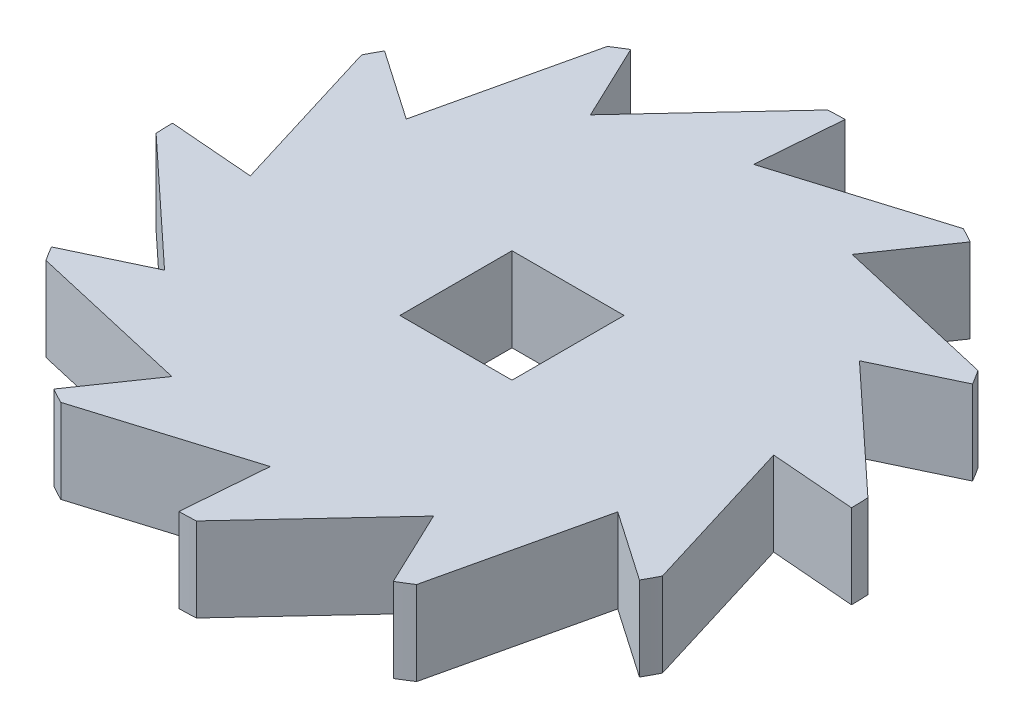
from build123d import *

# Parameters (mm, degrees)
SCHIZZO1_R                    = 30
SCHIZZO1_W                    = 10
SCHIZZO1_H                    = 10
ESTRUSIONE_ESTRUSIONE1_DEPTH  = 7.5
TAGLIO_ESTRUSIONE1_DEPTH      = 44.084219849
TAGLIO_ESTRUSIONE1_DEPTH_BACK = 44.084219849


with BuildPart() as part:
    # Schizzo1 → Estrusione-Estrusione1 (new body)
    with BuildSketch(Plane(origin=(0, 0, 0), x_dir=(1, 0, 0), z_dir=(0, 1, 0))):
        with Locations(Location((0, 0, 0), (0, 0, 270))):
            Circle(SCHIZZO1_R)
        Rectangle(SCHIZZO1_W, SCHIZZO1_H, mode=Mode.SUBTRACT)
    extrude(amount=ESTRUSIONE_ESTRUSIONE1_DEPTH)

    # Schizzo2 → Taglio-Estrusione1 (cut, two sides: drawn at the far end of the back side and taken through both)
    with BuildSketch(Plane(origin=(0, 7.5, 0), x_dir=(1, 0, 0), z_dir=(0, 1, 0)).offset(-TAGLIO_ESTRUSIONE1_DEPTH_BACK)):
        with BuildLine():
            Line((-19.887270315, 10.454237391), (-16.532028162, 25.033818024))
            ThreePointArc((-16.532028162, 25.033818024), (-21.93796515, 20.462787813), (-26.122238482, 14.75224243))
            Line((-26.122238482, 14.75224243), (-19.887270315, 10.454237391))
        make_face()
        with BuildLine():
            Line((-22.45, -0.89), (-26.834065376, 13.413908282))
            ThreePointArc((-26.834065376, 13.413908282), (-29.230229034, 6.752311504), (-29.998643344, -0.285302534))
            Line((-29.998643344, -0.285302534), (-22.45, -0.89))
        make_face()
        with BuildLine():
            Line((-18.997270315, -11.995762609), (-29.945936443, -1.800247352))
            ThreePointArc((-29.945936443, -1.800247352), (-28.690276653, -8.76744122), (-25.836935948, -15.246400914))
            Line((-25.836935948, -15.246400914), (-18.997270315, -11.995762609))
        make_face()
        with BuildLine():
            Line((-10.454237391, -19.887270315), (-25.033818024, -16.532028162))
            ThreePointArc((-25.033818024, -16.532028162), (-20.462787813, -21.93796515), (-14.75224243, -26.122238482))
            Line((-14.75224243, -26.122238482), (-10.454237391, -19.887270315))
        make_face()
        with BuildLine():
            ThreePointArc((-13.413908282, -26.834065376), (-6.752311504, -29.230229034), (0.285302534, -29.998643344))
            Line((0.285302534, -29.998643344), (0.89, -22.45))
            Line((0.89, -22.45), (-13.413908282, -26.834065376))
        make_face()
        with BuildLine():
            ThreePointArc((1.800247352, -29.945936443), (8.76744122, -28.690276653), (15.246400914, -25.836935948))
            Line((15.246400914, -25.836935948), (11.995762609, -18.997270315))
            Line((11.995762609, -18.997270315), (1.800247352, -29.945936443))
        make_face()
        with BuildLine():
            ThreePointArc((16.532028162, -25.033818024), (21.93796515, -20.462787813), (26.122238482, -14.75224243))
            Line((26.122238482, -14.75224243), (19.887270315, -10.454237391))
            Line((19.887270315, -10.454237391), (16.532028162, -25.033818024))
        make_face()
        with BuildLine():
            ThreePointArc((30, 0), (29.999660834, 0.14265288), (29.998643344, 0.285302534))
            Line((29.998643344, 0.285302534), (22.45, 0.89))
            Line((22.45, 0.89), (26.834065376, -13.413908282))
            ThreePointArc((26.834065376, -13.413908282), (29.197790681, -6.89122771), (30, 0))
        make_face()
        with BuildLine():
            ThreePointArc((29.945936443, 1.800247352), (28.690276653, 8.76744122), (25.836935948, 15.246400914))
            Line((25.836935948, 15.246400914), (18.997270315, 11.995762609))
            Line((18.997270315, 11.995762609), (29.945936443, 1.800247352))
        make_face()
        with BuildLine():
            Line((14.75224243, 26.122238482), (10.454237391, 19.887270315))
            Line((10.454237391, 19.887270315), (25.033818024, 16.532028162))
            ThreePointArc((25.033818024, 16.532028162), (20.462787813, 21.93796515), (14.75224243, 26.122238482))
        make_face()
        with BuildLine():
            Line((-0.89, 22.45), (13.413908282, 26.834065376))
            ThreePointArc((13.413908282, 26.834065376), (6.752311504, 29.230229034), (-0.285302534, 29.998643344))
            Line((-0.285302534, 29.998643344), (-0.89, 22.45))
        make_face()
        with BuildLine():
            Line((-11.995762609, 18.997270315), (-1.800247352, 29.945936443))
            ThreePointArc((-1.800247352, 29.945936443), (-8.76744122, 28.690276653), (-15.246400914, 25.836935948))
            Line((-15.246400914, 25.836935948), (-11.995762609, 18.997270315))
        make_face()
    extrude(amount=TAGLIO_ESTRUSIONE1_DEPTH + TAGLIO_ESTRUSIONE1_DEPTH_BACK, mode=Mode.SUBTRACT)


solid = part.part
